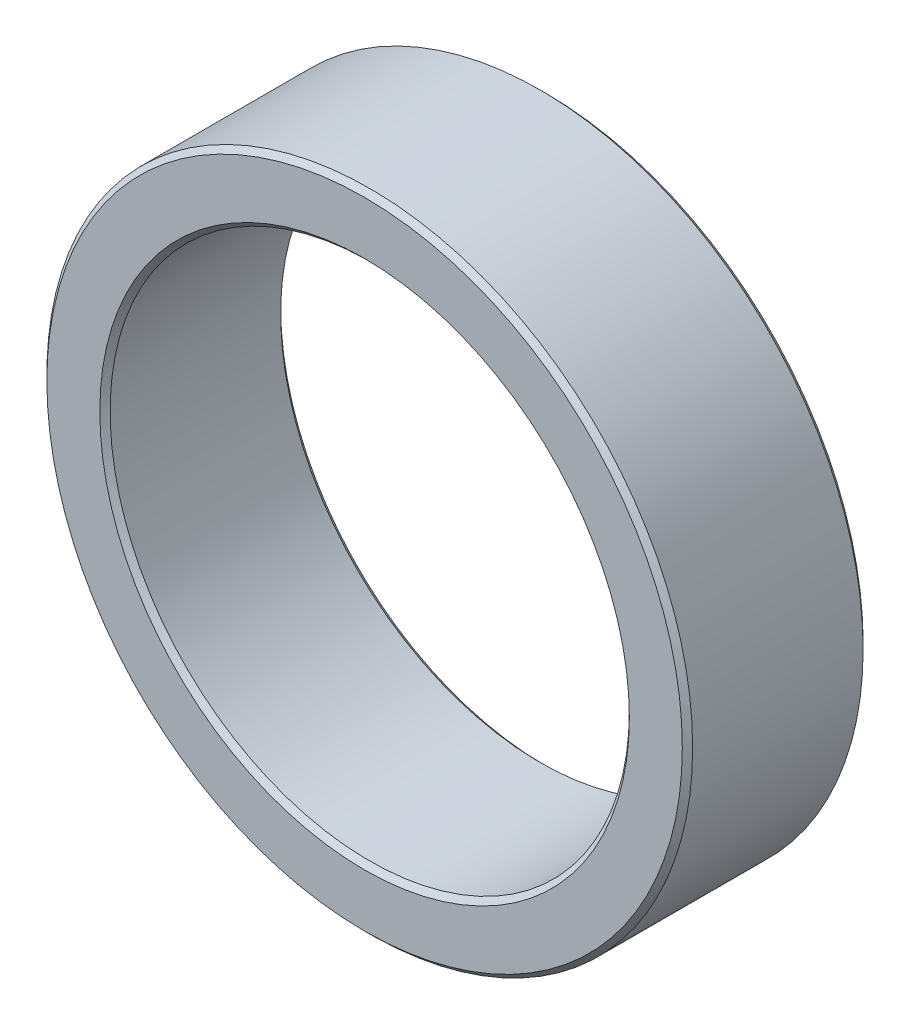
from build123d import *

# Parameters (mm, degrees)
SKETCH1_R           = 12.5
SKETCH1_R_2         = 10.05
BOSS_EXTRUDE1_DEPTH = 7
CHAMFER1_SIZE       = 0.2


with BuildPart() as part:
    # Sketch1 → Boss-Extrude1 (new body)
    with BuildSketch(Plane.XY):
        Circle(SKETCH1_R)
        Circle(SKETCH1_R_2, mode=Mode.SUBTRACT)
    extrude(amount=BOSS_EXTRUDE1_DEPTH)

    # Chamfer1
    chamfer1_edges = [part.edges().sort_by_distance(p)[0] for p in [
        (-12.5, 0, 0),
        (-12.5, 0, 7),
        (-10.05, 0, 0),
        (-10.05, 0, 7),
    ]]
    chamfer(chamfer1_edges, length=CHAMFER1_SIZE)


solid = part.part
